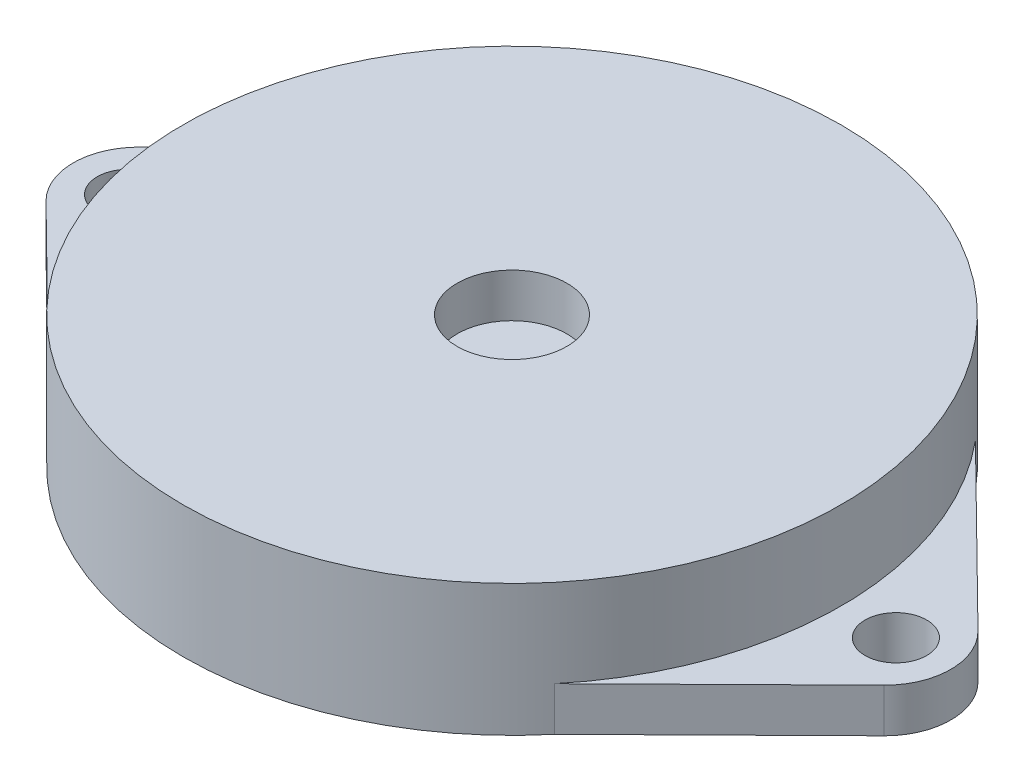
from build123d import *

# Parameters (mm, degrees)
SKETCH_1_R          = 15
EXTRUDE_1_DEPTH     = 6
SKETCH_2_R          = 2.5
CUT_EXTRUDE_1_DEPTH = 2
SKETCH_3_R          = 1.40543951
EXTRUDE_2_DEPTH     = 2


with BuildPart() as part:
    # 草图1 → 凸台-拉伸1 (new body)
    with BuildSketch(Plane(origin=(0, 0, 0), x_dir=(1, 0, 0), z_dir=(0, 1, 0))):
        with Locations(Location((0, 0, 0), (0, 0, 270))):
            Circle(SKETCH_1_R)
    extrude(amount=EXTRUDE_1_DEPTH)

    # 草图2 → 切除-拉伸1 (cut)
    with BuildSketch(Plane(origin=(0, 6, 0), x_dir=(1, 0, 0), z_dir=(0, 1, 0))):
        with Locations(Location((0, 0, 0), (0, 0, 270))):
            Circle(SKETCH_2_R)
    extrude(amount=-CUT_EXTRUDE_1_DEPTH, mode=Mode.SUBTRACT)

    # 草图3 → 凸台-拉伸2 (add)
    # profile 1 of 2: a face of its own
    with BuildSketch(Plane.XZ):
        with BuildLine():
            Line((-9.417192288, 11.675465276), (-19.104721401, 2.137790407))
            ThreePointArc((-19.104721401, 2.137790407), (-20, 0), (-19.104721401, -2.137790407))
            Line((-19.104721401, -2.137790407), (-9.417192288, -11.675465276))
            Line((-9.417192288, -11.675465276), (-9.417192288, 11.675465276))
        make_face()
        with Locations(Location((-17.5, 0, 0), (0, 0, 270))):
            Circle(SKETCH_3_R, mode=Mode.SUBTRACT)
    # profile 2 of 2: a face of its own
    with BuildSketch(Plane.XZ):
        with BuildLine():
            Line((9.417192288, 11.675465276), (9.417192288, -11.675465276))
            Line((9.417192288, -11.675465276), (19.104721401, -2.137790407))
            ThreePointArc((19.104721401, -2.137790407), (20, 0), (19.104721401, 2.137790407))
            Line((19.104721401, 2.137790407), (9.417192288, 11.675465276))
        make_face()
        with Locations(Location((17.5, 0, 0), (0, 0, 90))):
            Circle(SKETCH_3_R, mode=Mode.SUBTRACT)
    extrude(amount=-EXTRUDE_2_DEPTH)


solid = part.part
